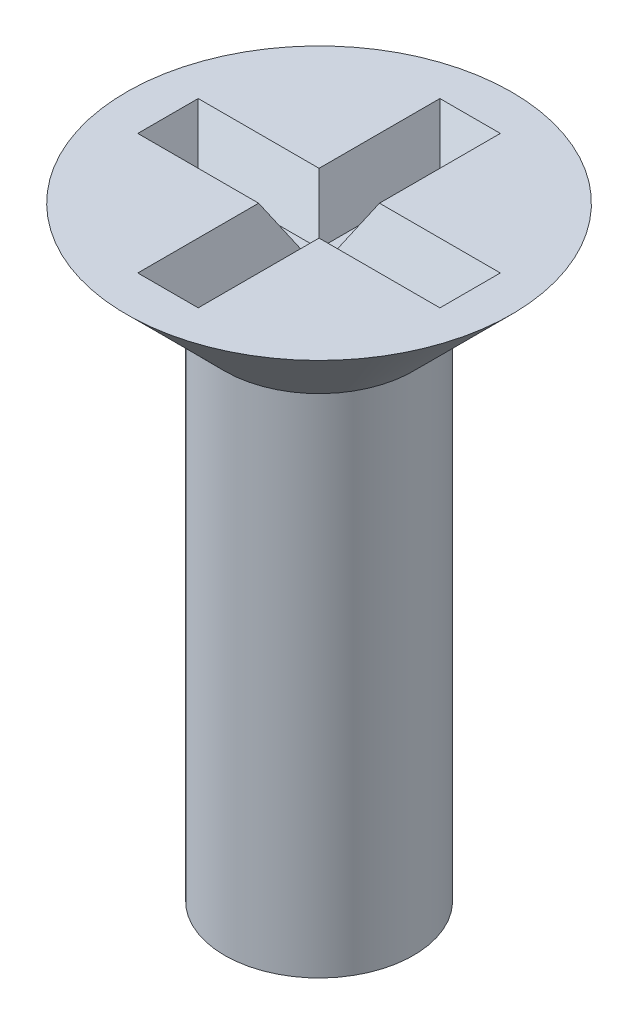
from build123d import *

# Parameters (mm, degrees)
CUT_EXTRUDE_1_DEPTH = 0.6
CUT_EXTRUDE_1_DRAFT = -28


with BuildPart() as part:
    # Эскиз1 → Повернуть1 (revolve)
    with BuildSketch(Plane.XY, mode=Mode.PRIVATE) as revolve_1_sk:
        Polygon((0, 8), (-2.55, 8), (-1.25, 6.7), (-1.25, 0), (0, 0), align=None)
    revolve(revolve_1_sk.sketch.rotate(Axis((0, 0, 0), (0, 1, 0)), 270), axis=Axis((0, 0, 0), (0, 1, 0)))


with BuildPart() as cut_extrude_1_tool:
    # Эскиз2 → Вырез-Вытянуть1 (with draft: the straight prism first)
    with BuildSketch(Plane(origin=(0, 8, 0), x_dir=(1, 0, 0), z_dir=(0, 1, 0))):
        Polygon((0.4, 0.4), (0.4, 2), (-0.4, 2), (-0.4, 0.4), (-2, 0.4), (-2, -0.4), (-0.4, -0.4), (-0.4, -2), (0.4, -2), (0.4, -0.4), (2, -0.4), (2, 0.4), align=None)
    extrude(amount=-CUT_EXTRUDE_1_DEPTH)
    # Вырез-Вытянуть1: the draft: its side faces are tilted about the plane it starts from
    cut_extrude_1_sides = [cut_extrude_1_tool.faces().sort_by_distance(p)[0] for p in [
        (0.4, 7.7, -1.2),
        (0, 7.7, -2),
        (-0.4, 7.7, -1.2),
        (-1.2, 7.7, -0.4),
        (-2, 7.7, 0),
        (-1.2, 7.7, 0.4),
        (-0.4, 7.7, 1.2),
        (0, 7.7, 2),
        (0.4, 7.7, 1.2),
        (1.2, 7.7, 0.4),
        (2, 7.7, 0),
        (1.2, 7.7, -0.4),
    ]]
    draft(cut_extrude_1_sides, Plane(origin=(0, 8, 0), x_dir=(1, 0, 0), z_dir=(0, 1, 0)), CUT_EXTRUDE_1_DRAFT)


with BuildPart() as part_1:
    add(part.part)

    # Вырез-Вытянуть1: cut by cut_extrude_1_tool
    add(cut_extrude_1_tool.part, mode=Mode.SUBTRACT)


solid = part_1.part
